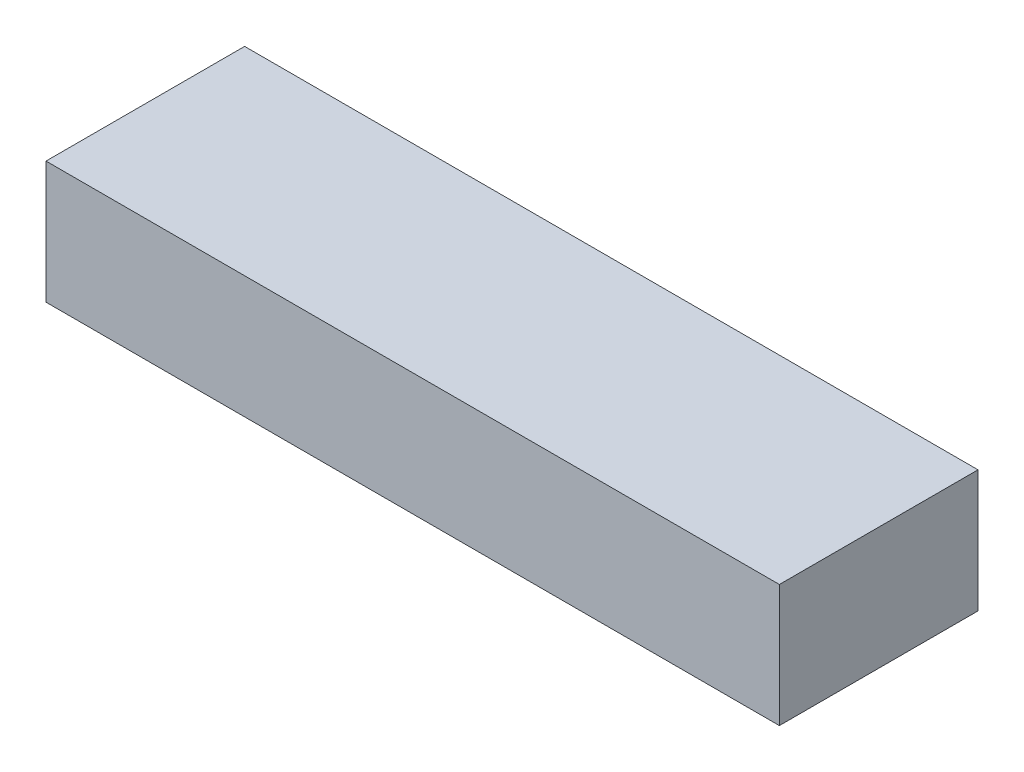
from build123d import *

# Parameters (mm, degrees)
SKETCH1_W           = 152.4
SKETCH1_H           = 41.275
BOSS_EXTRUDE1_DEPTH = 25.4


with BuildPart() as part:
    # Sketch1 → Boss-Extrude1 (new body)
    with BuildSketch(Plane(origin=(0, 0, 0), x_dir=(1, 0, 0), z_dir=(0, 1, 0))):
        with Locations((76.2, 20.6375)):
            Rectangle(SKETCH1_W, SKETCH1_H)
    extrude(amount=BOSS_EXTRUDE1_DEPTH)


solid = part.part
